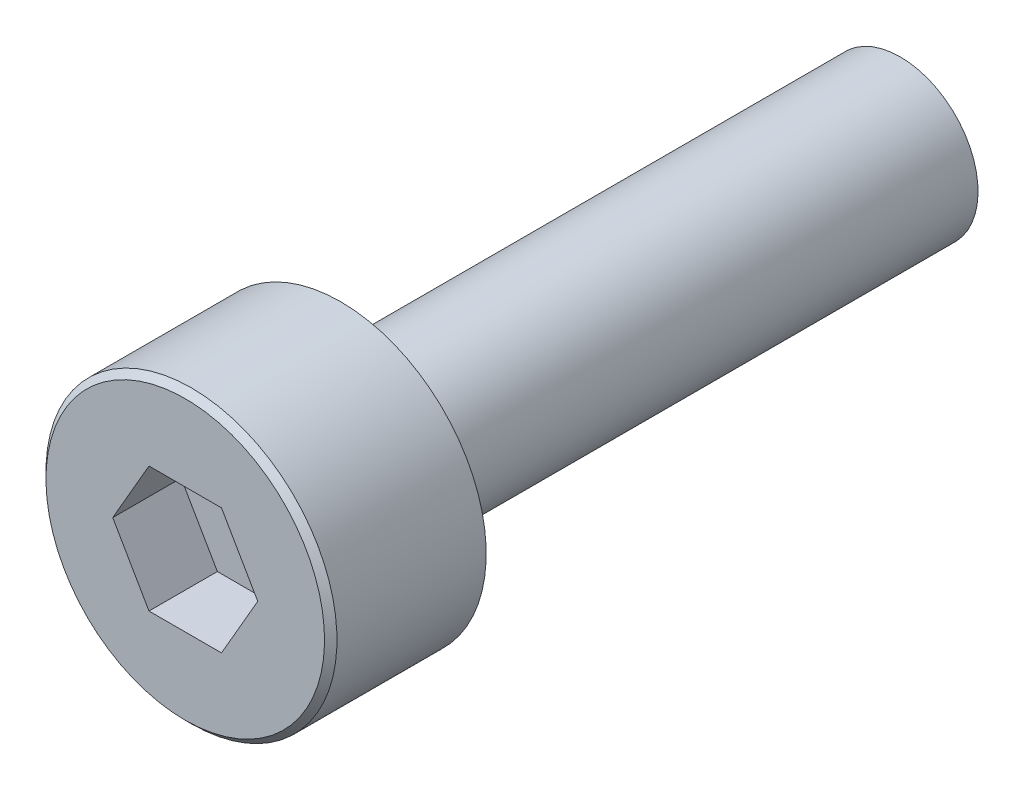
from build123d import *

# Parameters (mm, degrees)
CUT_EXTRUDE_1_DEPTH = 1.1
CHAMFER_628_SIZE    = 0.1


with BuildPart() as part:
    # 草图1 → 旋转1 (revolve)
    with BuildSketch(Plane(origin=(0, 0, 0), x_dir=(0, 0, -1), z_dir=(1, 0, 0))):
        Polygon((0, 0), (0, 2.34), (2.5, 2.34), (2.5, 1.25), (11.5, 1.25), (11.5, 0), align=None)
    revolve(axis=Axis((0, 0, -11.5), (0, 0, 1)))

    # 草图2 → 切除-拉伸1 (cut)
    with BuildSketch(Plane.XY):
        Polygon((0.583123772, 1.01), (-0.583123772, 1.01), (-1.166247544, 0), (-0.583123772, -1.01), (0.583123772, -1.01), (1.166247544, 0), align=None)
    extrude(amount=-CUT_EXTRUDE_1_DEPTH, mode=Mode.SUBTRACT)

    # Chamfer 628
    chamfer_628_edges = [part.edges().sort_by_distance(p)[0] for p in [
        (0, -2.34, 0),
    ]]
    chamfer(chamfer_628_edges, length=CHAMFER_628_SIZE)


solid = part.part
